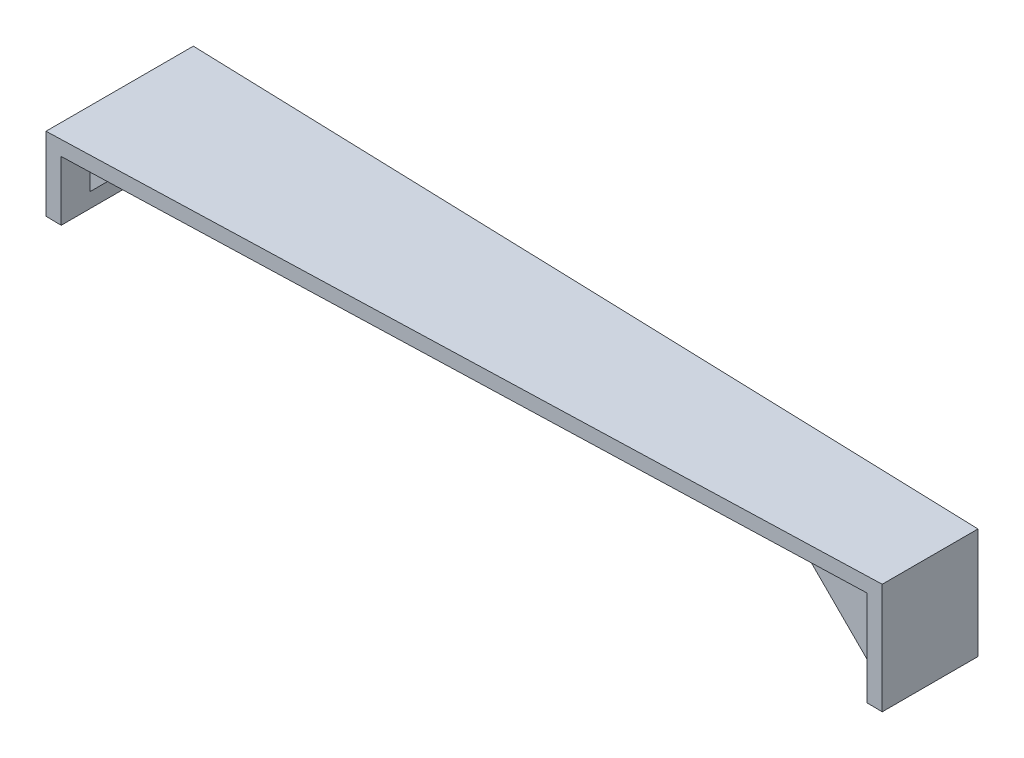
from build123d import *

# Parameters (mm, degrees)
BOSS_EXTRUDE1_DEPTH     = 2
BOSS_EXTRUDE2_DEPTH     = 13
CUT_EXTRUDE1_DEPTH      = 58.879184514
CUT_EXTRUDE1_DEPTH_BACK = 58.879184514
BOSS_EXTRUDE3_START     = 4
BOSS_EXTRUDE3_DEPTH     = 2


with BuildPart() as part:
    # Sketch2 → Boss-Extrude1 (new body)
    with BuildSketch(Plane(origin=(0, 0, 0), x_dir=(1, 0, 0), z_dir=(0, 1, 0))):
        Polygon((55, -6.5), (-55, -10), (-55, 10), (55, 6.5), align=None)
    extrude(amount=-BOSS_EXTRUDE1_DEPTH)

    # Sketch3 → Boss-Extrude2 (add)
    with BuildSketch(Plane.XZ.offset(2)):
        Polygon((-53, 9.936363636), (-53, -9.936363636), (-55, -10), (-55, 10), align=None)
        Polygon((53, -6.563636364), (53, 6.563636364), (55, 6.5), (55, -6.5), align=None)
    extrude(amount=BOSS_EXTRUDE2_DEPTH)

    # Sketch5 → Cut-Extrude1 (cut, two sides: drawn at the far end of the back side and taken through both)
    with BuildSketch(Plane.XY.offset(-CUT_EXTRUDE1_DEPTH_BACK)):
        Polygon((-55, -10), (55, -15), (55, -25), (-55, -25), align=None)
    extrude(amount=CUT_EXTRUDE1_DEPTH + CUT_EXTRUDE1_DEPTH_BACK, mode=Mode.SUBTRACT)

    # Sketch6 → Boss-Extrude3 (add)
    with BuildSketch(Plane.XY.offset(BOSS_EXTRUDE3_START)):
        Polygon((-53, -8.090909091), (-46.909090909, -2), (-53, -2), align=None)
        Polygon((53, -10.909090909), (53, -2), (44.090909091, -2), align=None)
    boss_extrude3 = extrude(amount=BOSS_EXTRUDE3_DEPTH)

    # Mirror1: Boss-Extrude3 across plane
    add(boss_extrude3.mirror(Plane.XY))


solid = part.part
